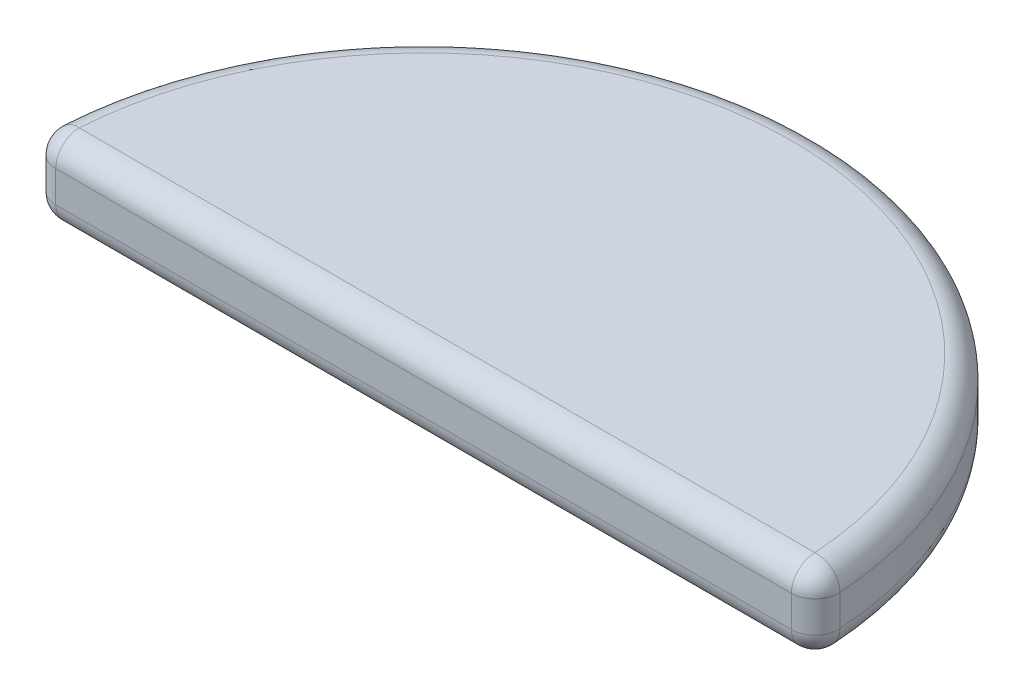
from build123d import *

# Parameters (mm, degrees)
BOSS_EXTRUDE1_DEPTH = 100
FILLET1_R           = 30


with BuildPart() as part:
    # Sketch1 → Boss-Extrude1 (new body)
    with BuildSketch(Plane(origin=(0, 0, 0), x_dir=(1, 0, 0), z_dir=(0, 1, 0))):
        with BuildLine():
            Line((0, 0), (1000, 0))
            ThreePointArc((1000, 0), (500, 500), (0, 0))
        make_face()
    extrude(amount=BOSS_EXTRUDE1_DEPTH)

    # Fillet1
    fillet1_edges = [part.edges().sort_by_distance(p)[0] for p in [
        (500, 0, 0),
        (500, 0, -500),
        (1000, 50, 0),
        (0, 50, 0),
        (500, 100, -500),
        (500, 100, 0),
    ]]
    fillet(fillet1_edges, radius=FILLET1_R)


solid = part.part
